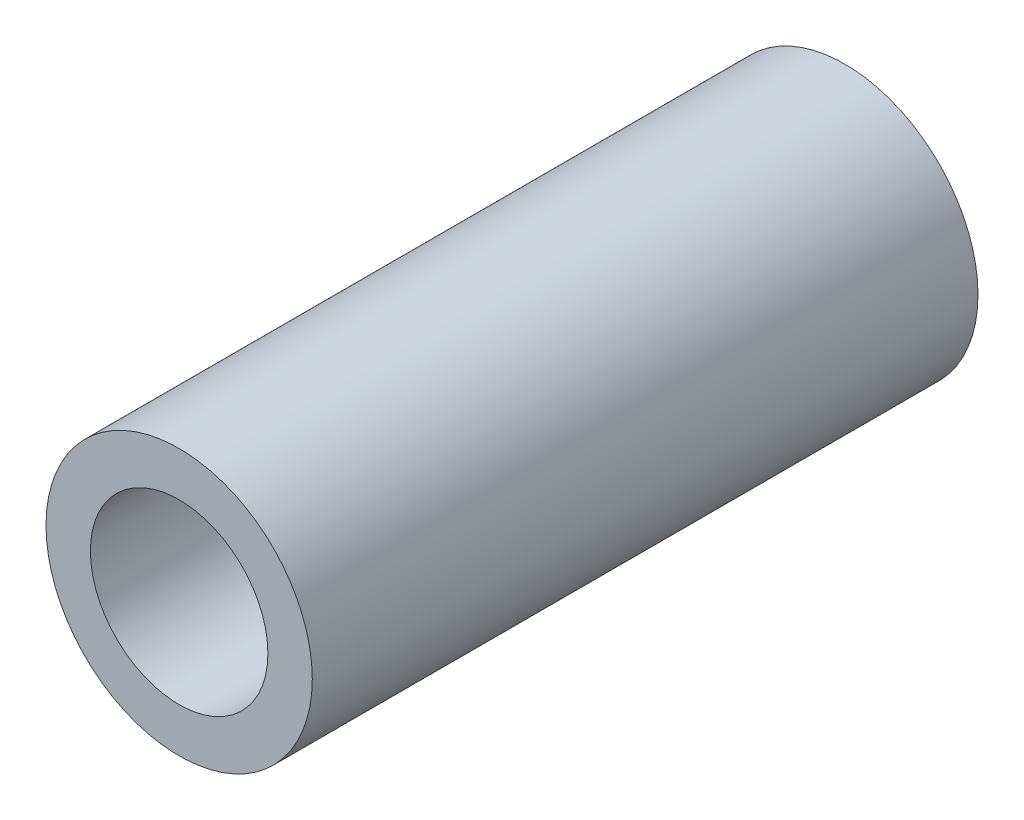
from build123d import *

# Parameters (mm, degrees)
SKETCH1_R           = 3
SKETCH1_R_2         = 2
BOSS_EXTRUDE1_DEPTH = 15


with BuildPart() as part:
    # Sketch1 → Boss-Extrude1 (new body)
    with BuildSketch(Plane.XY):
        with Locations((-20, -9.999990176)):
            Circle(SKETCH1_R)
        with Locations((-20, -9.999990176)):
            Circle(SKETCH1_R_2, mode=Mode.SUBTRACT)
    extrude(amount=BOSS_EXTRUDE1_DEPTH)


solid = part.part
